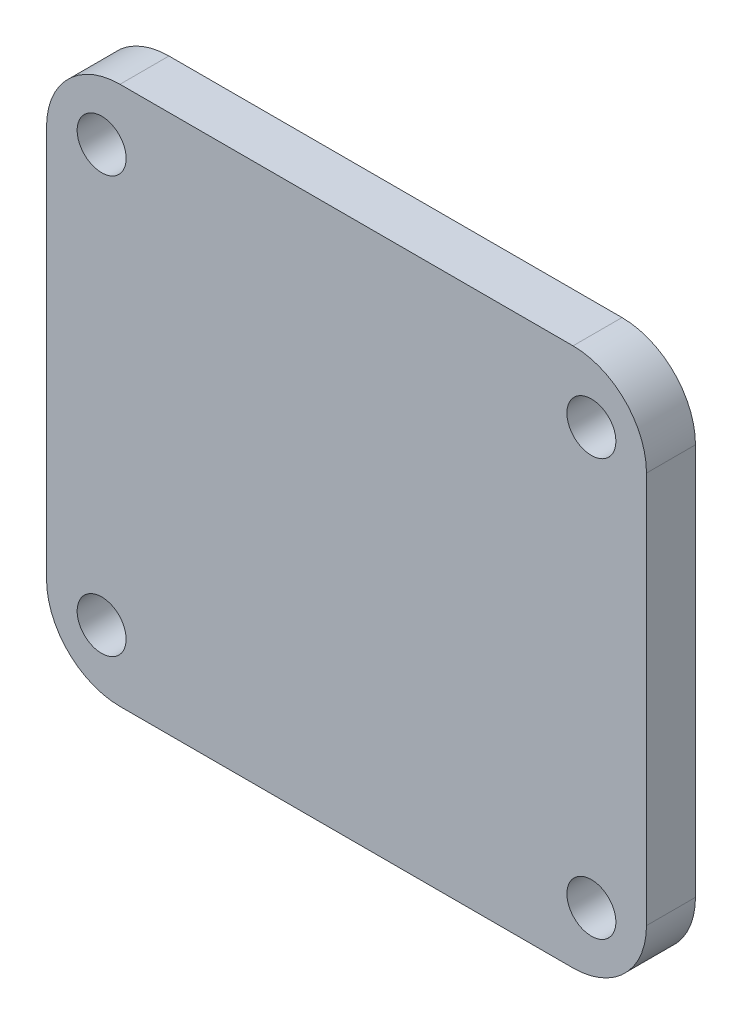
from build123d import *

# Parameters (mm, degrees)
SCHIZZO1_W                   = 24.5
SCHIZZO1_H                   = 22.0038
SCHIZZO1_R                   = 1
ESTRUSIONE_ESTRUSIONE1_DEPTH = 2
RACCORDO1_R                  = 3


with BuildPart() as part:
    # Schizzo1 → Estrusione-Estrusione1 (new body)
    with BuildSketch(Plane.XY):
        with Locations((10, 8.5)):
            Rectangle(SCHIZZO1_W, SCHIZZO1_H)
        Circle(SCHIZZO1_R, mode=Mode.SUBTRACT)
        with Locations((20, 0)):
            Circle(SCHIZZO1_R, mode=Mode.SUBTRACT)
        with Locations((20, 17)):
            Circle(SCHIZZO1_R, mode=Mode.SUBTRACT)
        with Locations((0, 17)):
            Circle(SCHIZZO1_R, mode=Mode.SUBTRACT)
    extrude(amount=ESTRUSIONE_ESTRUSIONE1_DEPTH)

    # Raccordo1
    raccordo1_edges = [part.edges().sort_by_distance(p)[0] for p in [
        (22.25, -2.5019, 1),
        (-2.25, -2.5019, 1),
        (-2.25, 19.5019, 1),
        (22.25, 19.5019, 1),
    ]]
    fillet(raccordo1_edges, radius=RACCORDO1_R)


solid = part.part
